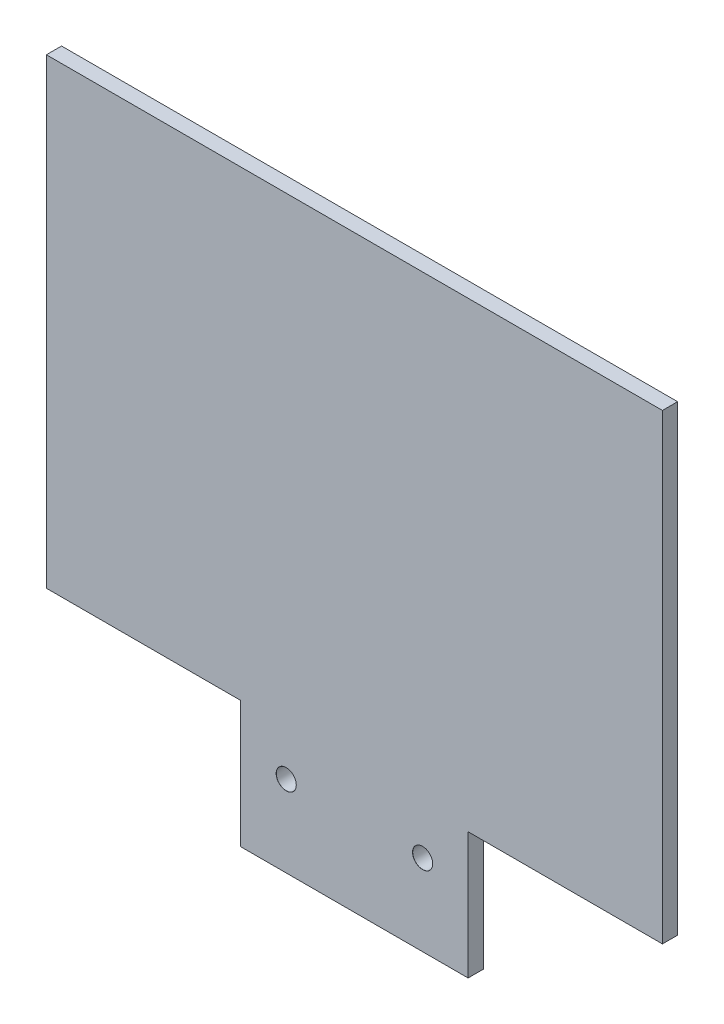
from build123d import *

# Parameters (mm, degrees)
BOSS_EXTRUDE2_DEPTH            = 5
M6_CLEARANCE_HOLE2_D           = 6.6
M6_CLEARANCE_HOLE2_CSINK_D     = 6.65
M6_CLEARANCE_HOLE2_CSINK_ANGLE = 90


with BuildPart() as part:
    # Sketch1 → Boss-Extrude2 (new body)
    with BuildSketch(Plane.XY):
        Polygon((-37.5, 20.889), (-101.6, 20.889), (-101.6, 173.289), (101.6, 173.289), (101.6, 20.889), (37.5, 20.889), (37.5, -20.889), (-37.5, -20.889), align=None)
    extrude(amount=BOSS_EXTRUDE2_DEPTH)

    # M6 Clearance Hole2 (through all)
    with Locations(Plane.XY.offset(5)):
        with Locations((-22.5, 5.889), (22.5, 5.889)):
            CounterSinkHole(M6_CLEARANCE_HOLE2_D / 2, M6_CLEARANCE_HOLE2_CSINK_D / 2, counter_sink_angle=M6_CLEARANCE_HOLE2_CSINK_ANGLE)


solid = part.part
